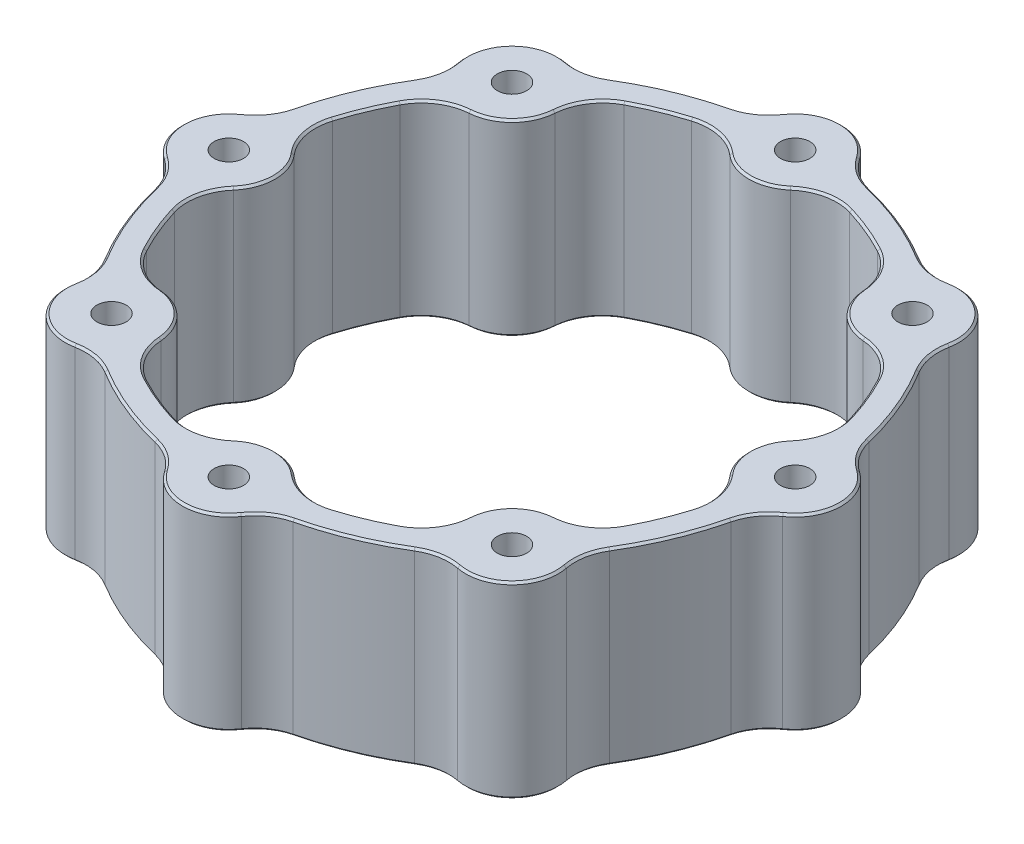
from build123d import *

# Parameters (mm, degrees)
SKETCH1_R                      = 9
SKETCH1_R_2                    = 57.5
SKETCH1_R_3                    = 52.5
BOSS_EXTRUDE1_DEPTH            = 36.5
M4_CLEARANCE_HOLE1_D           = 4.5
F_5_7_5_7_DIAMETER_HOLE1_D     = 5.7
F_5_7_5_7_DIAMETER_HOLE1_DEPTH = 10
F_5_7_5_7_DIAMETER_HOLE1_TIP   = 1.712452764
F_5_7_5_7_DIAMETER_HOLE2_D     = 5.7
F_5_7_5_7_DIAMETER_HOLE2_DEPTH = 10
F_5_7_5_7_DIAMETER_HOLE2_TIP   = 1.712452764
FILLET2_R                      = 10
CHAMFER1_SIZE                  = 0.4


with BuildPart() as part:
    # Sketch1 → Boss-Extrude1 (new body)
    # profile 1 of 9: a face of its own
    with BuildSketch(Plane(origin=(0, 0, 0), x_dir=(1, 0, 0), z_dir=(0, 1, 0))):
        with Locations((0, 55)):
            Circle(SKETCH1_R)
    # profile 2 of 9: a face of its own
    with BuildSketch(Plane(origin=(0, 0, 0), x_dir=(1, 0, 0), z_dir=(0, 1, 0))):
        with Locations((55, 0)):
            Circle(SKETCH1_R)
    # profile 3 of 9: a face of its own
    with BuildSketch(Plane(origin=(0, 0, 0), x_dir=(1, 0, 0), z_dir=(0, 1, 0))):
        with Locations((0, -55)):
            Circle(SKETCH1_R)
    # profile 4 of 9: a face of its own
    with BuildSketch(Plane(origin=(0, 0, 0), x_dir=(1, 0, 0), z_dir=(0, 1, 0))):
        with Locations((-55, 0)):
            Circle(SKETCH1_R)
    # profile 5 of 9: a face of its own
    with BuildSketch(Plane(origin=(0, 0, 0), x_dir=(1, 0, 0), z_dir=(0, 1, 0))):
        Circle(SKETCH1_R_2)
        Circle(SKETCH1_R_3, mode=Mode.SUBTRACT)
    # profile 6 of 9: a face of its own
    with BuildSketch(Plane(origin=(0, 0, 0), x_dir=(1, 0, 0), z_dir=(0, 1, 0))):
        with Locations((-38.890872965, 38.890872965)):
            Circle(SKETCH1_R)
    # profile 7 of 9: a face of its own
    with BuildSketch(Plane(origin=(0, 0, 0), x_dir=(1, 0, 0), z_dir=(0, 1, 0))):
        with Locations((-38.890872965, -38.890872965)):
            Circle(SKETCH1_R)
    # profile 8 of 9: a face of its own
    with BuildSketch(Plane(origin=(0, 0, 0), x_dir=(1, 0, 0), z_dir=(0, 1, 0))):
        with Locations((38.890872965, -38.890872965)):
            Circle(SKETCH1_R)
    # profile 9 of 9: a face of its own
    with BuildSketch(Plane(origin=(0, 0, 0), x_dir=(1, 0, 0), z_dir=(0, 1, 0))):
        with Locations((38.890872965, 38.890872965)):
            Circle(SKETCH1_R)
    extrude(amount=BOSS_EXTRUDE1_DEPTH)

    # M4 Clearance Hole1 (through all)
    with Locations(Plane(origin=(0, 36.5, 0), x_dir=(1, 0, 0), z_dir=(0, 1, 0))):
        with Locations((0, 55), (38.890872965, 38.890872965), (55, 0), (38.890872965, -38.890872965), (0, -55), (-38.890872965, -38.890872965), (-55, 0), (-38.890872965, 38.890872965)):
            Hole(M4_CLEARANCE_HOLE1_D / 2)

    # Ø5.7 (5.7) Diameter Hole1
    with Locations(Plane(origin=(0, 36.5, 0), x_dir=(1, 0, 0), z_dir=(0, 1, 0))):
        with Locations((0, 55), (38.890872965, 38.890872965), (55, 0), (38.890872965, -38.890872965), (0, -55), (-38.890872965, -38.890872965), (-55, 0), (-38.890872965, 38.890872965)):
            Hole(F_5_7_5_7_DIAMETER_HOLE1_D / 2, depth=F_5_7_5_7_DIAMETER_HOLE1_DEPTH)
            with Locations((0, 0, -(F_5_7_5_7_DIAMETER_HOLE1_DEPTH + F_5_7_5_7_DIAMETER_HOLE1_TIP / 2))):  # 118° drill point
                Cone(0, F_5_7_5_7_DIAMETER_HOLE1_D / 2, F_5_7_5_7_DIAMETER_HOLE1_TIP, mode=Mode.SUBTRACT)

    # Ø5.7 (5.7) Diameter Hole2
    with Locations(Plane(origin=(0, 0, 0), x_dir=(-1, 0, 0), z_dir=(0, -1, 0))):
        with Locations((0, 55), (38.890872965, 38.890872965), (55, 0), (38.890872965, -38.890872965), (0, -55), (-38.890872965, -38.890872965), (-55, 0), (-38.890872965, 38.890872965)):
            Hole(F_5_7_5_7_DIAMETER_HOLE2_D / 2, depth=F_5_7_5_7_DIAMETER_HOLE2_DEPTH)
            with Locations((0, 0, -(F_5_7_5_7_DIAMETER_HOLE2_DEPTH + F_5_7_5_7_DIAMETER_HOLE2_TIP / 2))):  # 118° drill point
                Cone(0, F_5_7_5_7_DIAMETER_HOLE2_D / 2, F_5_7_5_7_DIAMETER_HOLE2_TIP, mode=Mode.SUBTRACT)

    # Fillet2
    fillet2_edges = [part.edges().sort_by_distance(p)[0] for p in [
        (-51.820454545, 18.25, -8.419649084),
        (-51.820454545, 18.25, 8.419649084),
        (-42.596185776, 18.25, 30.689003851),
        (-30.689003851, 18.25, 42.596185776),
        (-8.419649084, 18.25, 51.820454545),
        (8.419649084, 18.25, 51.820454545),
        (30.689003851, 18.25, 42.596185776),
        (42.596185776, 18.25, 30.689003851),
        (51.820454545, 18.25, 8.419649084),
        (51.820454545, 18.25, -8.419649084),
        (42.596185776, 18.25, -30.689003851),
        (30.689003851, 18.25, -42.596185776),
        (-30.689003851, 18.25, -42.596185776),
        (-42.596185776, 18.25, -30.689003851),
        (46.410541785, 18.25, 33.945715653),
        (33.945715653, 18.25, 46.410541785),
        (8.813963084, 18.25, 56.820454545),
        (-8.813963084, 18.25, 56.820454545),
        (-33.945715653, 18.25, 46.410541785),
        (-46.410541785, 18.25, 33.945715653),
        (-56.820454545, 18.25, 8.813963084),
        (-56.820454545, 18.25, -8.813963084),
        (-46.410541785, 18.25, -33.945715653),
        (-33.945715653, 18.25, -46.410541785),
        (33.945715653, 18.25, -46.410541785),
        (46.410541785, 18.25, -33.945715653),
        (56.820454545, 18.25, -8.813963084),
        (56.820454545, 18.25, 8.813963084),
        (-8.813963084, 18.25, -56.820454545),
        (8.813963084, 18.25, -56.820454545),
        (-8.419649084, 18.25, -51.820454545),
        (8.419649084, 18.25, -51.820454545),
    ]]
    fillet(fillet2_edges, radius=FILLET2_R)

    # Chamfer1
    chamfer1_edges = [part.edges().sort_by_distance(p)[0] for p in [
        (22.004297361, 36.5, -53.123073119),
        (22.004297361, 0, -53.123073119),
        (45.254833996, 0, -45.254833996),
        (45.254833996, 36.5, -45.254833996),
        (53.123073119, 0, -22.004297361),
        (53.123073119, 36.5, -22.004297361),
        (64, 0, 0),
        (64, 36.5, 0),
        (53.123073119, 0, 22.004297361),
        (53.123073119, 36.5, 22.004297361),
        (45.254833996, 0, 45.254833996),
        (45.254833996, 36.5, 45.254833996),
        (22.004297361, 0, 53.123073119),
        (22.004297361, 36.5, 53.123073119),
        (0, 0, 64),
        (0, 36.5, 64),
        (-22.004297361, 0, 53.123073119),
        (-22.004297361, 36.5, 53.123073119),
        (-45.254833996, 0, 45.254833996),
        (-45.254833996, 36.5, 45.254833996),
        (-53.123073119, 0, 22.004297361),
        (-53.123073119, 36.5, 22.004297361),
        (-64, 0, 0),
        (-64, 36.5, 0),
        (-53.123073119, 0, -22.004297361),
        (-53.123073119, 36.5, -22.004297361),
        (-45.254833996, 0, -45.254833996),
        (-45.254833996, 36.5, -45.254833996),
        (-22.004297361, 0, -53.123073119),
        (-22.004297361, 36.5, -53.123073119),
        (0, 36.5, -64),
        (0, 0, -64),
        (-20.090880199, 0, -48.503675457),
        (-20.090880199, 36.5, -48.503675457),
        (-32.526911935, 0, -32.526911935),
        (-32.526911935, 36.5, -32.526911935),
        (-48.503675457, 0, -20.090880199),
        (-48.503675457, 36.5, -20.090880199),
        (-46, 0, 0),
        (-46, 36.5, 0),
        (-48.503675457, 0, 20.090880199),
        (-48.503675457, 36.5, 20.090880199),
        (-32.526911935, 0, 32.526911935),
        (-32.526911935, 36.5, 32.526911935),
        (-20.090880199, 0, 48.503675457),
        (-20.090880199, 36.5, 48.503675457),
        (0, 0, 46),
        (0, 36.5, 46),
        (20.090880199, 0, 48.503675457),
        (20.090880199, 36.5, 48.503675457),
        (32.526911935, 0, 32.526911935),
        (32.526911935, 36.5, 32.526911935),
        (48.503675457, 0, 20.090880199),
        (48.503675457, 36.5, 20.090880199),
        (46, 0, 0),
        (46, 36.5, 0),
        (48.503675457, 0, -20.090880199),
        (48.503675457, 36.5, -20.090880199),
        (32.526911935, 0, -32.526911935),
        (32.526911935, 36.5, -32.526911935),
        (20.090880199, 36.5, -48.503675457),
        (20.090880199, 0, -48.503675457),
        (0, 36.5, -46),
        (0, 0, -46),
        (33.497105121, 0, -47.70558973),
        (33.497105121, 36.5, -47.70558973),
        (47.70558973, 0, -33.497105121),
        (47.70558973, 36.5, -33.497105121),
        (57.41897618, 0, -10.046915817),
        (57.41897618, 36.5, -10.046915817),
        (57.41897618, 0, 10.046915817),
        (57.41897618, 36.5, 10.046915817),
        (47.70558973, 0, 33.497105121),
        (47.70558973, 36.5, 33.497105121),
        (33.497105121, 0, 47.70558973),
        (33.497105121, 36.5, 47.70558973),
        (10.046915817, 0, 57.41897618),
        (10.046915817, 36.5, 57.41897618),
        (-10.046915817, 0, 57.41897618),
        (-10.046915817, 36.5, 57.41897618),
        (-33.497105121, 0, 47.70558973),
        (-33.497105121, 36.5, 47.70558973),
        (-47.70558973, 0, 33.497105121),
        (-47.70558973, 36.5, 33.497105121),
        (-57.41897618, 0, 10.046915817),
        (-57.41897618, 36.5, 10.046915817),
        (-57.41897618, 0, -10.046915817),
        (-57.41897618, 36.5, -10.046915817),
        (-47.70558973, 0, -33.497105121),
        (-47.70558973, 36.5, -33.497105121),
        (-33.497105121, 0, -47.70558973),
        (-33.497105121, 36.5, -47.70558973),
        (-10.046915817, 36.5, -57.41897618),
        (-10.046915817, 0, -57.41897618),
        (10.046915817, 0, -57.41897618),
        (10.046915817, 36.5, -57.41897618),
        (-28.320484759, 0, -42.987408011),
        (-28.320484759, 36.5, -42.987408011),
        (-42.987408011, 0, -28.320484759),
        (-42.987408011, 36.5, -28.320484759),
        (-50.42229453, 0, -10.371080891),
        (-50.42229453, 36.5, -10.371080891),
        (-50.42229453, 0, 10.371080891),
        (-50.42229453, 36.5, 10.371080891),
        (-42.987408011, 0, 28.320484759),
        (-42.987408011, 36.5, 28.320484759),
        (-10.371080891, 0, 50.42229453),
        (-10.371080891, 36.5, 50.42229453),
        (10.371080891, 0, 50.42229453),
        (10.371080891, 36.5, 50.42229453),
        (28.320484759, 0, 42.987408011),
        (28.320484759, 36.5, 42.987408011),
        (42.987408011, 0, 28.320484759),
        (42.987408011, 36.5, 28.320484759),
        (50.42229453, 0, 10.371080891),
        (50.42229453, 36.5, 10.371080891),
        (50.42229453, 0, -10.371080891),
        (50.42229453, 36.5, -10.371080891),
        (42.987408011, 0, -28.320484759),
        (42.987408011, 36.5, -28.320484759),
        (28.320484759, 0, -42.987408011),
        (28.320484759, 36.5, -42.987408011),
        (10.371080891, 0, -50.42229453),
        (10.371080891, 36.5, -50.42229453),
        (-10.371080891, 36.5, -50.42229453),
        (-10.371080891, 0, -50.42229453),
        (-28.320484759, 0, 42.987408011),
        (-28.320484759, 36.5, 42.987408011),
    ]]
    chamfer(chamfer1_edges, length=CHAMFER1_SIZE)


solid = part.part
